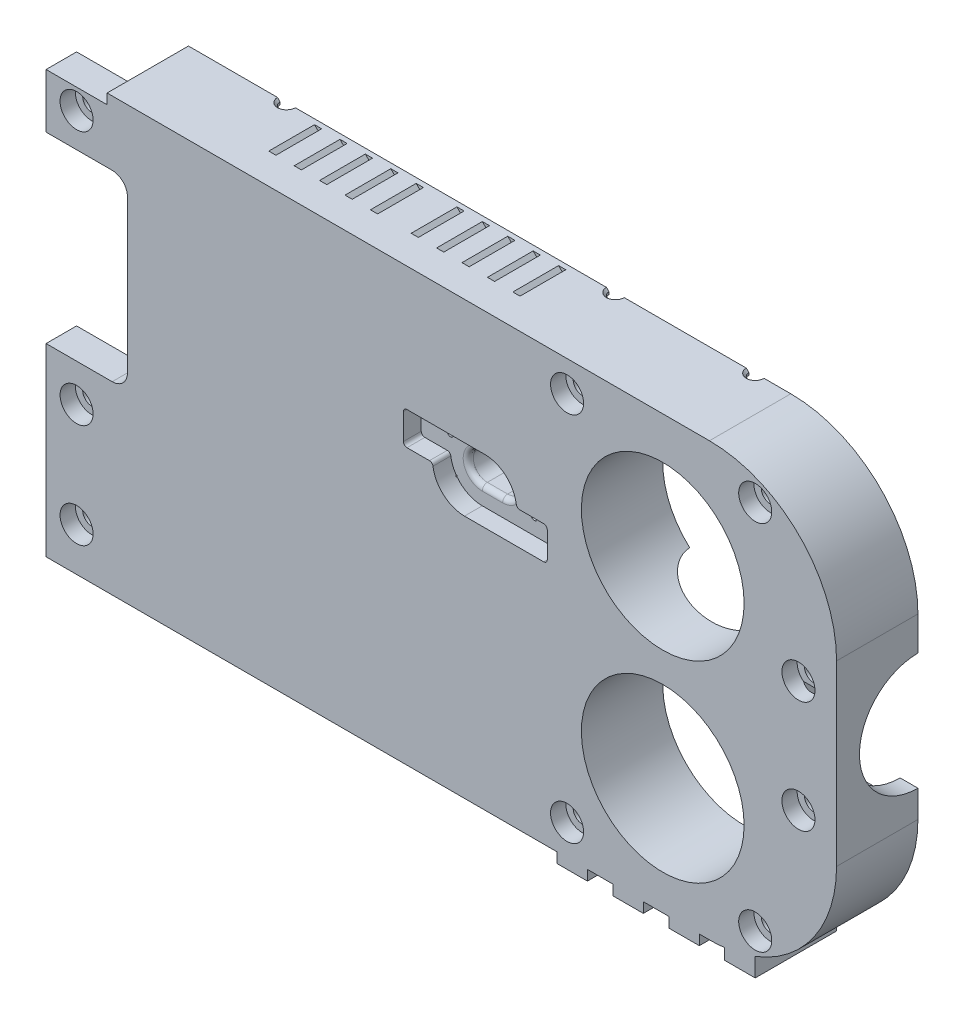
from build123d import *

# Parameters (mm, degrees)
MAIN_BODY_DEPTH                                      = 16
FLYWHEEL_ESC_CLEARANCE_DEPTH                         = 10
FLYWHEEL_ESC_WIRE_DEPTH                              = 7
DRIVE_STEPPER_CLEARANCE_REACH                        = 160.191
DRIVE_BELT_CLEARANCE_DEPTH                           = 3.3
CLIP_CLEARANCE_DEPTH                                 = 40.5
CLIP_HEAD_CLEARANCE_DEPTH                            = 13
FLYWHEEL_CLEARANCE_REACH                             = 160.191
SKETCH16_R                                           = 16
SKETCH17_W                                           = 12
SKETCH17_H                                           = 10
CUT_EXTRUDE17_DEPTH                                  = 83
M3_TAPPED_HOLE1_D                                    = 2.5
M3_TAPPED_HOLE1_DEPTH                                = 16
M3_TAPPED_HOLE1_TIP                                  = 0.751075774
CBORE_FOR_M3_HEX_SOCKET_THIN_HEAD_CAP_SC_D           = 3.6
CBORE_FOR_M3_HEX_SOCKET_THIN_HEAD_CAP_SC_CBORE_D     = 6.5
CBORE_FOR_M3_HEX_SOCKET_THIN_HEAD_CAP_SC_CBORE_DEPTH = 3
FILLET1_R                                            = 7
CUT_EXTRUDE19_DEPTH                                  = 3.5
M1_6_TAPPED_HOLE1_D                                  = 1.25
M1_6_TAPPED_HOLE1_DEPTH                              = 5
M1_6_TAPPED_HOLE1_TIP                                = 0.375537887
CUT_EXTRUDE20_REACH                                  = 159.875
VARFILLET1_R                                         = 1
CUT_EXTRUDE21_DEPTH                                  = 1.5
SKETCH29_W                                           = 51.659518048
SKETCH29_H                                           = 2.245304486
BOSS_EXTRUDE1_DEPTH                                  = 1
CUT_EXTRUDE22_DEPTH                                  = 5.5
M3_TAPPED_HOLE2_D                                    = 2.5
M3_TAPPED_HOLE2_DEPTH                                = 4
M3_TAPPED_HOLE2_CSINK_D                              = 3.5
M3_TAPPED_HOLE2_CSINK_ANGLE                          = 90
M3_TAPPED_HOLE2_TIP                                  = 0.751075774


with BuildPart() as part:
    # Sketch1 → main body (new body)
    with BuildSketch(Plane.XY):
        with BuildLine():
            Line((84.634238464, 37.676192421), (84.634238464, 34))
            Line((84.634238464, 34), (78.634238464, 34))
            Line((78.634238464, 34), (78.634238464, 36.180652708))
            ThreePointArc((78.634238464, 36.180652708), (77.13695562, 36.045204045), (75.634238464, 36))
            Line((75.634238464, 36), (73.634238464, 36))
            Line((73.634238464, 36), (73.634238464, 34))
            Line((73.634238464, 34), (67.634238464, 34))
            Line((67.634238464, 34), (67.634238464, 36))
            Line((67.634238464, 36), (62.634238464, 36))
            Line((62.634238464, 36), (62.634238464, 34))
            Line((62.634238464, 34), (56.634238464, 34))
            Line((56.634238464, 34), (56.634238464, 36))
            Line((56.634238464, 36), (51.634238464, 36))
            Line((51.634238464, 36), (51.634238464, 34))
            Line((51.634238464, 34), (45.634238464, 34))
            Line((45.634238464, 34), (45.634238464, 36))
            Line((45.634238464, 36), (40.177209114, 36))
            Line((40.177209114, 36), (-54.822790886, 36))
            Line((-54.822790886, 36), (-54.822790886, 119))
            Line((-54.822790886, 119), (-42.822790886, 119))
            Line((-42.822790886, 119), (-42.822790886, 121))
            Line((-42.822790886, 121), (75.634238464, 121))
            ThreePointArc((75.634238464, 121), (93.311907994, 113.67766953), (100.634238464, 96))
            Line((100.634238464, 96), (100.634238464, 61))
            ThreePointArc((100.634238464, 61), (96.249766592, 46.857864376), (84.634238464, 37.676192421))
        make_face()
    extrude(amount=MAIN_BODY_DEPTH)

    # Sketch2 → flywheel_esc_clearance (cut)
    with BuildSketch(Plane(origin=(0, 0, 0), x_dir=(-1, 0, 0), z_dir=(0, 0, -1))):
        Polygon((-10.21561795, 111.047588733), (-7.21561795, 111.047588733), (-7.21561795, 108.754695514), (-2.21561795, 108.754695514), (-2.21561795, 111.754695514), (17.78438205, 111.754695514), (17.78438205, 114.004695514), (20.28438205, 114.004695514), (20.28438205, 116.504695514), (17.78438205, 116.504695514), (17.78438205, 118.754695514), (14.78438205, 118.754695514), (17.029686535, 121), (15.615472973, 121), (13.370168487, 118.754695514), (9.78438205, 118.754695514), (12.029686535, 121), (10.615472973, 121), (8.370168487, 118.754695514), (4.78438205, 118.754695514), (7.029686535, 121), (5.615472973, 121), (3.370168487, 118.754695514), (-0.21561795, 118.754695514), (2.029686535, 121), (0.615472973, 121), (-1.629831513, 118.754695514), (-5.21561795, 118.754695514), (-2.970313465, 121), (-4.384527027, 121), (-6.629831513, 118.754695514), (-7.21561795, 118.754695514), (-7.21561795, 116.504695514), (-10.21561795, 116.504695514), (-10.21561795, 118.754695514), (-13.21561795, 118.754695514), (-10.970313465, 121), (-12.384527027, 121), (-14.629831513, 118.754695514), (-18.21561795, 118.754695514), (-15.970313465, 121), (-17.384527027, 121), (-19.629831513, 118.754695514), (-23.21561795, 118.754695514), (-20.970313465, 121), (-22.384527027, 121), (-24.629831513, 118.754695514), (-28.21561795, 118.754695514), (-25.970313465, 121), (-27.384527027, 121), (-29.629831513, 118.754695514), (-33.21561795, 118.754695514), (-30.970313465, 121), (-32.384527027, 121), (-34.629831513, 118.754695514), (-35.21561795, 118.754695514), (-35.21561795, 116.504695514), (-37.71561795, 116.504695514), (-37.71561795, 114.004695514), (-35.21561795, 114.004695514), (-35.21561795, 111.754695514), (-15.21561795, 111.754695514), (-15.21561795, 108.754695514), (-10.21561795, 108.754695514), align=None)
    extrude(amount=-FLYWHEEL_ESC_CLEARANCE_DEPTH, mode=Mode.SUBTRACT)

    # Sketch4 → Flywheel_esc_wire (cut)
    with BuildSketch(Plane(origin=(0, 0, 0), x_dir=(-1, 0, 0), z_dir=(0, 0, -1))):
        with BuildLine():
            Line((27.822790886, 116.754695514), (27.822790886, 114.254695514))
            ThreePointArc((27.822790886, 114.254695514), (27.529897667, 113.547588733), (26.822790886, 113.254695514))
            Line((26.822790886, 113.254695514), (17.78438205, 113.254695514))
            Line((17.78438205, 113.254695514), (17.78438205, 111.754695514))
            Line((17.78438205, 111.754695514), (-29.652085773, 111.754695514))
            Line((-29.652085773, 111.754695514), (-29.652085773, 118.754695514))
            Line((-29.652085773, 118.754695514), (-32.652085773, 118.754695514))
            Line((-32.652085773, 118.754695514), (-32.652085773, 108.754695514))
            Line((-32.652085773, 108.754695514), (31.822790886, 108.754695514))
            ThreePointArc((31.822790886, 108.754695514), (32.529897667, 109.047588733), (32.822790886, 109.754695514))
            Line((32.822790886, 109.754695514), (32.822790886, 110.754695514))
            ThreePointArc((32.822790886, 110.754695514), (33.115684105, 111.461802296), (33.822790886, 111.754695514))
            Line((33.822790886, 111.754695514), (42.822790886, 111.754695514))
            Line((42.822790886, 111.754695514), (42.822790886, 117.754695514))
            Line((42.822790886, 117.754695514), (28.822790886, 117.754695514))
            ThreePointArc((28.822790886, 117.754695514), (28.115684105, 117.461802296), (27.822790886, 116.754695514))
        make_face()
    extrude(amount=-FLYWHEEL_ESC_WIRE_DEPTH, mode=Mode.SUBTRACT)

    # Sketch6 → drive_Stepper_clearance (cut, up to next)
    with BuildSketch(Plane(origin=(0, 0, 0), x_dir=(-1, 0, 0), z_dir=(0, 0, -1)), mode=Mode.PRIVATE) as drive_stepper_clearance_sk1:
        with BuildLine():
            Line((41.822790886, 108.33001947), (54.822790886, 108.33001947))
            Line((54.822790886, 108.33001947), (54.822790886, 72.33001947))
            Line((54.822790886, 72.33001947), (41.822790886, 72.33001947))
            ThreePointArc((41.822790886, 72.33001947), (39.701470543, 73.208699126), (38.822790886, 75.33001947))
            Line((38.822790886, 75.33001947), (38.822790886, 105.33001947))
            ThreePointArc((38.822790886, 105.33001947), (39.701470543, 107.451339814), (41.822790886, 108.33001947))
        make_face()
    drive_stepper_clearance_tool1 = extrude(drive_stepper_clearance_sk1.sketch, amount=-DRIVE_STEPPER_CLEARANCE_REACH, mode=Mode.PRIVATE) & part.part
    add(drive_stepper_clearance_tool1.solids().sort_by_distance((-46.872279, 90.330019, 0))[0], mode=Mode.SUBTRACT)

    # Sketch7 → drive_belt_clearance (cut)
    with BuildSketch(Plane(origin=(0, 0, 0), x_dir=(-1, 0, 0), z_dir=(0, 0, -1))):
        with BuildLine():
            Line((-36.587995126, 85.103182499), (38.822790886, 85.103182499))
            Line((38.822790886, 85.103182499), (38.822790886, 98.83))
            Line((38.822790886, 98.83), (-34.957904234, 98.83))
            ThreePointArc((-34.957904234, 98.83), (-38.49343814, 97.365533906), (-39.957904234, 93.83))
            Line((-39.957904234, 93.83), (-39.957904234, 89.83))
            ThreePointArc((-39.957904234, 89.83), (-39.029172738, 86.927454088), (-36.587995126, 85.103182499))
        make_face()
    extrude(amount=-DRIVE_BELT_CLEARANCE_DEPTH, mode=Mode.SUBTRACT)

    # Sketch12 → barrel (revolve, cut)
    with BuildSketch(Plane(origin=(0, 0, 0), x_dir=(-1, 0, 0), z_dir=(0, 0, -1))):
        Polygon((-100.634238464, 89.33), (-97.134238464, 89.33), (-97.134238464, 93.33), (-89.134238464, 93.33), (-89.134238464, 84.83), (-44.977209114, 84.83), (-27.977209114, 86.83), (38.822790886, 86.83), (38.822790886, 77.83), (-93.134238464, 77.83), (-100.634238464, 77.83), align=None)
    revolve(axis=Axis((100.634238464, 77.83, 0), (-1, 0, 0)), mode=Mode.SUBTRACT)

    # Sketch14 → clip clearance (cut)
    with BuildSketch(Plane.XZ.offset(-36)):
        Polygon((40.177209114, 9.807012356), (40.177209114, 0), (-41.822790886, 0), (-41.822790886, 9.807012356), (-31.822790886, 11.340345689), (-31.822790886, 10.733333333), (-30.222790886, 10.978666667), (-30.222790886, 11.585679022), (-28.820032834, 11.80076859), (-28.820032834, 9.5), (-24.320032834, 9.5), (-24.320032834, 14), (-13.422790886, 14), (-13.422790886, 13), (-11.822790886, 13), (-11.822790886, 14), (10.177209114, 14), (10.177209114, 13), (11.777209114, 13), (11.777209114, 14), (25.177209114, 14), (25.177209114, 12.107012356), (28.577209114, 11.585679022), (28.577209114, 10.978666667), (30.177209114, 10.733333333), (30.177209114, 11.340345689), align=None)
    extrude(amount=-CLIP_CLEARANCE_DEPTH, mode=Mode.SUBTRACT)

    # Sketch15 → clip-head clearance (cut)
    with BuildSketch(Plane.XZ.offset(-76.5)):
        Polygon((-24.320032834, 0), (-24.320032834, 14), (-13.422790886, 14), (-13.422790886, 13), (-11.822790886, 13), (-11.822790886, 14), (10.177209114, 14), (10.177209114, 13), (11.777209114, 13), (11.777209114, 14), (22.464967166, 14), (22.464967166, 0), align=None)
    extrude(amount=-CLIP_HEAD_CLEARANCE_DEPTH, mode=Mode.SUBTRACT)

    # Sketch16 → flywheel_clearance (cut, up to next)
    with BuildSketch(Plane(origin=(0, 0, 0), x_dir=(-1, 0, 0), z_dir=(0, 0, -1)), mode=Mode.PRIVATE) as flywheel_clearance_sk1:
        with Locations(Location((-66.450434282, 96.74, 0), (0, 0, 311.894555783))):
            Circle(SKETCH16_R)
    flywheel_clearance_tool1 = extrude(flywheel_clearance_sk1.sketch, amount=-FLYWHEEL_CLEARANCE_REACH, mode=Mode.PRIVATE) & part.part
    # Sketch16 → flywheel_clearance (cut, up to next)
    with BuildSketch(Plane(origin=(0, 0, 0), x_dir=(-1, 0, 0), z_dir=(0, 0, -1)), mode=Mode.PRIVATE) as flywheel_clearance_sk2:
        with Locations(Location((-66.450434282, 58.92, 0), (0, 0, 48.105444217))):
            Circle(SKETCH16_R)
    flywheel_clearance_tool2 = extrude(flywheel_clearance_sk2.sketch, amount=-FLYWHEEL_CLEARANCE_REACH, mode=Mode.PRIVATE) & part.part
    add(flywheel_clearance_tool1.solids().sort_by_distance((66.450434, 96.74, 0))[0], mode=Mode.SUBTRACT)
    add(flywheel_clearance_tool2.solids().sort_by_distance((66.450434, 58.92, 0))[0], mode=Mode.SUBTRACT)

    # Sketch17 → Cut-Extrude17 (cut)
    with BuildSketch(Plane(origin=(0, 119, 0), x_dir=(1, 0, 0), z_dir=(0, 1, 0))):
        with Locations((-48.822790886, -5)):
            Rectangle(SKETCH17_W, SKETCH17_H)
    extrude(amount=-CUT_EXTRUDE17_DEPTH, mode=Mode.SUBTRACT)

    # M3 Tapped Hole1
    with Locations(Plane(origin=(0, 36, 0), x_dir=(-1, 0, 0), z_dir=(0, -1, 0))):
        with Locations((44.822790886, -12.5), (-41.677209114, -12.5)):
            Hole(M3_TAPPED_HOLE1_D / 2, depth=M3_TAPPED_HOLE1_DEPTH)
            with Locations((0, 0, -(M3_TAPPED_HOLE1_DEPTH + M3_TAPPED_HOLE1_TIP / 2))):  # 118° drill point
                Cone(0, M3_TAPPED_HOLE1_D / 2, M3_TAPPED_HOLE1_TIP, mode=Mode.SUBTRACT)

    # CBORE for M3 Hex Socket Thin Head Cap Screw1 (through all)
    with Locations(Plane.XY.offset(16)):
        with Locations((93.134238464, 88.83), (93.134238464, 66.83), (84.634238464, 115), (47.634238464, 115), (47.634238464, 42), (84.634238464, 42), (-48.822790886, 44.50734437), (-48.822790886, 64.952229105), (-48.822790886, 115)):
            CounterBoreHole(CBORE_FOR_M3_HEX_SOCKET_THIN_HEAD_CAP_SC_D / 2, CBORE_FOR_M3_HEX_SOCKET_THIN_HEAD_CAP_SC_CBORE_D / 2, CBORE_FOR_M3_HEX_SOCKET_THIN_HEAD_CAP_SC_CBORE_DEPTH)

    # Fillet1
    fillet1_edges = [part.edges().sort_by_distance(p)[0] for p in [
        (-0.822790886, 89.5, 14),
    ]]
    fillet(fillet1_edges, radius=FILLET1_R)

    # Sketch23 → Cut-Extrude19 (cut)
    with BuildSketch(Plane.XY.offset(16)):
        with BuildLine():
            Line((16.157904234, 96.58), (31.457904234, 96.58))
            ThreePointArc((31.457904234, 96.58), (35.564181233, 95.041792569), (37.649240377, 91.184316547))
            ThreePointArc((37.649240377, 91.184316547), (37.882767002, 90.752279232), (38.342670026, 90.58))
            Line((38.342670026, 90.58), (43.040307117, 90.58))
            ThreePointArc((43.040307117, 90.58), (43.535281864, 90.374974747), (43.740307117, 89.88))
            Line((43.740307117, 89.88), (43.740307117, 84.78))
            ThreePointArc((43.740307117, 84.78), (43.535281864, 84.285025253), (43.040307117, 84.08))
            Line((43.040307117, 84.08), (27.457904234, 84.08))
            ThreePointArc((27.457904234, 84.08), (23.351627235, 85.618207431), (21.266568091, 89.475683453))
            ThreePointArc((21.266568091, 89.475683453), (21.033041467, 89.907720768), (20.573138443, 90.08))
            Line((20.573138443, 90.08), (16.157904234, 90.08))
            ThreePointArc((16.157904234, 90.08), (15.662929487, 90.285025253), (15.457904234, 90.78))
            Line((15.457904234, 90.78), (15.457904234, 95.88))
            ThreePointArc((15.457904234, 95.88), (15.662929487, 96.374974747), (16.157904234, 96.58))
        make_face()
    extrude(amount=-CUT_EXTRUDE19_DEPTH, mode=Mode.SUBTRACT)

    # M1.6 Tapped Hole1
    with Locations(Plane.XY.offset(12.5)):
        with Locations((21.212906236, 93.33), (37.702902233, 87.33)):
            Hole(M1_6_TAPPED_HOLE1_D / 2, depth=M1_6_TAPPED_HOLE1_DEPTH)
            with Locations((0, 0, -(M1_6_TAPPED_HOLE1_DEPTH + M1_6_TAPPED_HOLE1_TIP / 2))):  # 118° drill point
                Cone(0, M1_6_TAPPED_HOLE1_D / 2, M1_6_TAPPED_HOLE1_TIP, mode=Mode.SUBTRACT)

    # Sketch27 → Cut-Extrude20 (cut, up to next)
    with BuildSketch(Plane.XY.offset(12.5), mode=Mode.PRIVATE) as cut_extrude20_sk1:
        with BuildLine():
            Line((27.457904234, 87.58), (31.457904234, 87.58))
            ThreePointArc((31.457904234, 87.58), (34.207904234, 90.33), (31.457904234, 93.08))
            Line((31.457904234, 93.08), (27.457904234, 93.08))
            ThreePointArc((27.457904234, 93.08), (24.707904234, 90.33), (27.457904234, 87.58))
        make_face()
    cut_extrude20_tool1 = extrude(cut_extrude20_sk1.sketch, amount=-CUT_EXTRUDE20_REACH, mode=Mode.PRIVATE) & part.part
    add(cut_extrude20_tool1.solids().sort_by_distance((29.457904, 90.33, 12.5))[0], mode=Mode.SUBTRACT)

    # VarFillet1
    varfillet1_edges = [part.edges().sort_by_distance(p)[0] for p in [
        (24.707904234, 90.33, 12.5),
    ]]
    fillet(varfillet1_edges, radius=VARFILLET1_R)

    # Sketch28 → Cut-Extrude21 (cut)
    with BuildSketch(Plane(origin=(0, 0, 3.3), x_dir=(-1, 0, 0), z_dir=(0, 0, -1))):
        with BuildLine():
            Line((-27.457904234, 95.83), (-31.457904234, 95.83))
            ThreePointArc((-31.457904234, 95.83), (-36.957904234, 90.33), (-31.457904234, 84.83))
            Line((-31.457904234, 84.83), (-27.457904234, 84.83))
            ThreePointArc((-27.457904234, 84.83), (-21.957904234, 90.33), (-27.457904234, 95.83))
        make_face()
    extrude(amount=-CUT_EXTRUDE21_DEPTH, mode=Mode.SUBTRACT)

    # Sketch29 → Boss-Extrude1 (add)
    with BuildSketch(Plane(origin=(0, 0, 0), x_dir=(-1, 0, 0), z_dir=(0, 0, -1))):
        with Locations((-8.800072489, 119.877347757)):
            Rectangle(SKETCH29_W, SKETCH29_H)
    extrude(amount=-BOSS_EXTRUDE1_DEPTH)

    # Sketch30 → Cut-Extrude22 (cut)
    with BuildSketch(Plane(origin=(0, 0, 0), x_dir=(-1, 0, 0), z_dir=(0, 0, -1))):
        with BuildLine():
            Line((27.322790886, 116.004695514), (27.322790886, 119))
            ThreePointArc((27.322790886, 119), (27.029897667, 119.707106781), (26.322790886, 120))
            Line((26.322790886, 120), (20.78438205, 120))
            ThreePointArc((20.78438205, 120), (20.077275269, 119.707106781), (19.78438205, 119))
            Line((19.78438205, 119), (19.78438205, 116.004695514))
            ThreePointArc((19.78438205, 116.004695514), (20.296945183, 114.767258647), (21.53438205, 114.254695514))
            Line((21.53438205, 114.254695514), (25.572790886, 114.254695514))
            ThreePointArc((25.572790886, 114.254695514), (26.810227753, 114.767258647), (27.322790886, 116.004695514))
        make_face()
        with BuildLine():
            Line((-73.134238464, 114), (-69.884238464, 114))
            Line((-69.884238464, 114), (-67.384238464, 114))
            Line((-67.384238464, 114), (-64.134238464, 114))
            ThreePointArc((-64.134238464, 114), (-63.427131683, 114.292893219), (-63.134238464, 115))
            Line((-63.134238464, 115), (-63.134238464, 119))
            ThreePointArc((-63.134238464, 119), (-63.427131683, 119.707106781), (-64.134238464, 120))
            Line((-64.134238464, 120), (-67.384238464, 120))
            Line((-67.384238464, 120), (-69.884238464, 120))
            Line((-69.884238464, 120), (-73.134238464, 120))
            ThreePointArc((-73.134238464, 120), (-73.841345245, 119.707106781), (-74.134238464, 119))
            Line((-74.134238464, 119), (-74.134238464, 115))
            ThreePointArc((-74.134238464, 115), (-73.841345245, 114.292893219), (-73.134238464, 114))
        make_face()
        with BuildLine():
            Line((-39.884238464, 120), (-42.384238464, 120))
            Line((-42.384238464, 120), (-43.134238464, 120))
            ThreePointArc((-43.134238464, 120), (-43.841345245, 119.707106781), (-44.134238464, 119))
            Line((-44.134238464, 119), (-44.134238464, 110))
            ThreePointArc((-44.134238464, 110), (-43.841345245, 109.292893219), (-43.134238464, 109))
            Line((-43.134238464, 109), (-39.134238464, 109))
            ThreePointArc((-39.134238464, 109), (-38.427131683, 109.292893219), (-38.134238464, 110))
            Line((-38.134238464, 110), (-38.134238464, 119))
            ThreePointArc((-38.134238464, 119), (-38.427131683, 119.707106781), (-39.134238464, 120))
            Line((-39.134238464, 120), (-39.884238464, 120))
        make_face()
    extrude(amount=-CUT_EXTRUDE22_DEPTH, mode=Mode.SUBTRACT)

    # M3 Tapped Hole2
    with Locations(Plane(origin=(0, 121, 0), x_dir=(1, 0, 0), z_dir=(0, 1, 0))):
        with Locations((41.134238464, 0), (-23.553586468, 0), (68.634238464, 0)):
            CounterSinkHole(M3_TAPPED_HOLE2_D / 2, M3_TAPPED_HOLE2_CSINK_D / 2, depth=M3_TAPPED_HOLE2_DEPTH, counter_sink_angle=M3_TAPPED_HOLE2_CSINK_ANGLE)
            with Locations((0, 0, -(M3_TAPPED_HOLE2_DEPTH + M3_TAPPED_HOLE2_TIP / 2))):  # 118° drill point
                Cone(0, M3_TAPPED_HOLE2_D / 2, M3_TAPPED_HOLE2_TIP, mode=Mode.SUBTRACT)


solid = part.part
